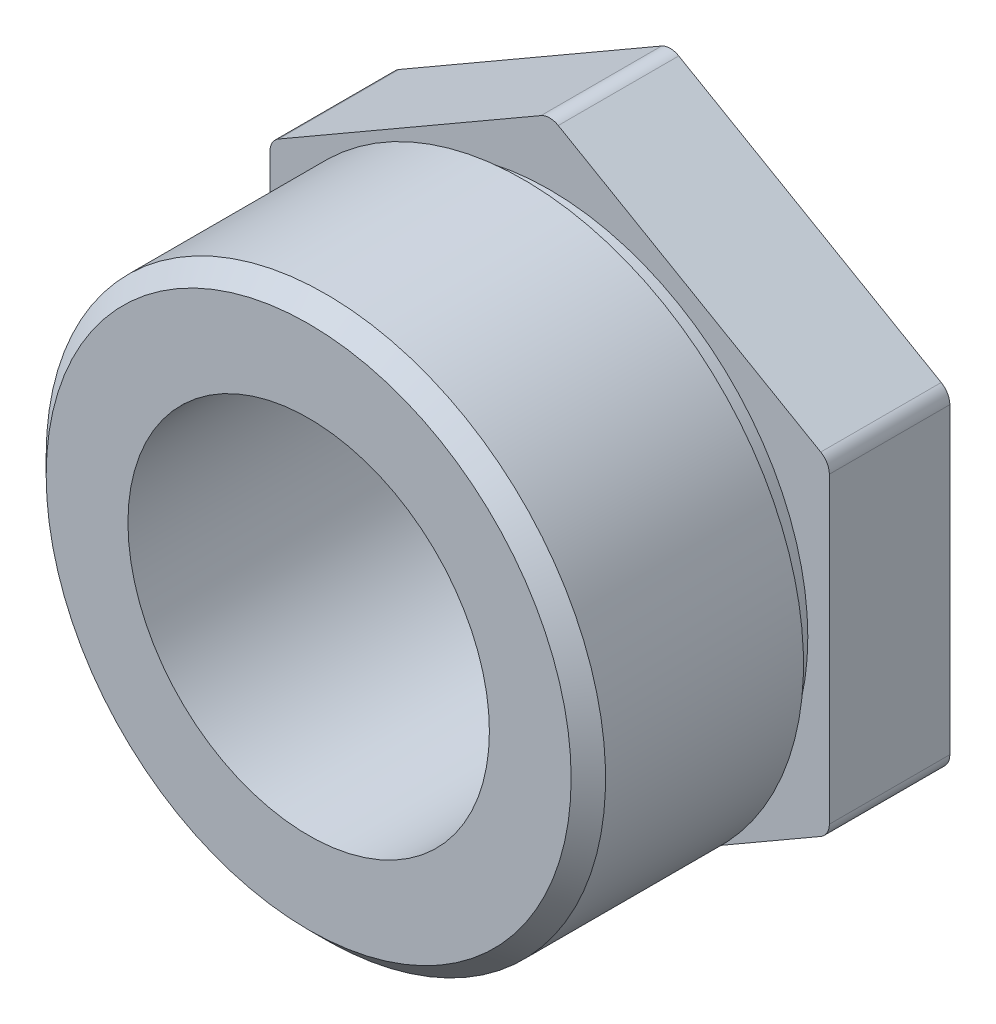
from build123d import *

# Parameters (mm, degrees)
SKETCH1_R           = 32.5
BOSS_EXTRUDE1_DEPTH = 42
CUT_EXTRUDE1_START  = -28
SKETCH2_R           = 32.5
SKETCH2_R_2         = 30
CUT_EXTRUDE1_DEPTH  = 3
BOSS_EXTRUDE2_DEPTH = 14
FILLET1_R           = 2
CHAMFER1_SIZE       = 2
SKETCH4_R           = 21
CUT_EXTRUDE2_DEPTH  = 65.849493437


with BuildPart() as part:
    # Sketch1 → Boss-Extrude1 (new body)
    with BuildSketch(Plane.XY):
        with Locations(Location((0, 0, 0), (0, 0, 180))):
            Circle(SKETCH1_R)
    extrude(amount=BOSS_EXTRUDE1_DEPTH)

    # Sketch2 → Cut-Extrude1 (cut)
    with BuildSketch(Plane.XY.offset(42).offset(CUT_EXTRUDE1_START)):
        with Locations(Location((0, 0, 0), (0, 0, 180))):
            Circle(SKETCH2_R)
        Circle(SKETCH2_R_2, mode=Mode.SUBTRACT)
    extrude(amount=CUT_EXTRUDE1_DEPTH, mode=Mode.SUBTRACT)

    # Sketch3 → Boss-Extrude2 (add)
    with BuildSketch(Plane(origin=(0, 0, 0), x_dir=(-1, 0, 0), z_dir=(0, 0, -1))):
        Polygon((-32.5, 18.763883749), (-32.5, -18.763883749), (0, -37.527767497), (32.5, -18.763883749), (32.5, 18.763883749), (0, 37.527767497), align=None)
    extrude(amount=-BOSS_EXTRUDE2_DEPTH)

    # Fillet1
    fillet1_edges = [part.edges().sort_by_distance(p)[0] for p in [
        (32.5, 18.763883749, 7),
        (0, 37.527767497, 7),
        (-32.5, 18.763883749, 7),
        (-32.5, -18.763883749, 7),
        (0, -37.527767497, 7),
        (32.5, -18.763883749, 7),
    ]]
    fillet(fillet1_edges, radius=FILLET1_R)

    # Chamfer1
    chamfer1_edges = [part.edges().sort_by_distance(p)[0] for p in [
        (32.5, 0, 42),
    ]]
    chamfer(chamfer1_edges, length=CHAMFER1_SIZE)

    # Sketch4 → Cut-Extrude2 (cut, through all)
    with BuildSketch(Plane.XY.offset(42)):
        Circle(SKETCH4_R)
    extrude(amount=-CUT_EXTRUDE2_DEPTH, mode=Mode.SUBTRACT)


solid = part.part
